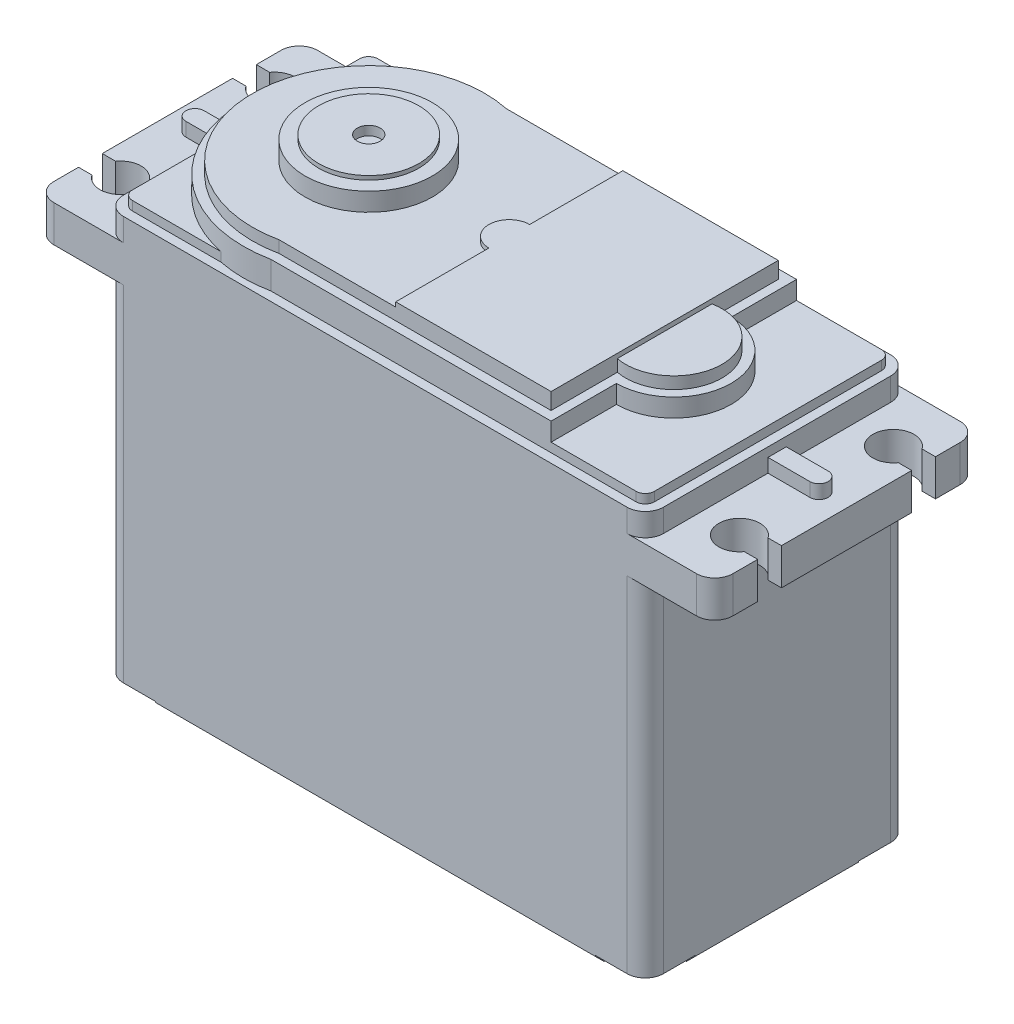
from build123d import *

# Parameters (mm, degrees)
CROQUIS1_W                  = 59.1
CROQUIS1_H                  = 28.85
SALIENTE_EXTRUIR1_DEPTH     = 22.65
CORTAR_EXTRUIR1_DEPTH       = 1.1
CHAFL_N1_SIZE               = 1
REDONDEO1_R                 = 2
SALIENTE_EXTRUIR2_DEPTH     = 4
REDONDEO2_R                 = 2
SALIENTE_EXTRUIR3_DEPTH     = 1.5
SALIENTE_EXTRUIR4_DEPTH     = 1
SALIENTE_EXTRUIR5_DEPTH     = 3
SALIENTE_EXTRUIR6_DEPTH     = 1.3
CROQUIS8_R                  = 6.96
SALIENTE_EXTRUIR7_DEPTH     = 2
CROQUIS9_R                  = 5.485
SALIENTE_EXTRUIR8_DEPTH     = 0.44
CROQUIS10_R                 = 1.25
CORTAR_EXTRUIR2_DEPTH       = 1
TALADRO_DE_MARGEN_PARA_81_D = 4.4958
SALIENTE_EXTRUIR9_DEPTH     = 0.5


with BuildPart() as part:
    # Croquis1 → Saliente-Extruir1 (new, symmetric)
    with BuildSketch(Plane(origin=(0, 0, 0), x_dir=(1, 0, 0), z_dir=(0, 1, 0))):
        Rectangle(CROQUIS1_W, CROQUIS1_H)
    extrude(amount=SALIENTE_EXTRUIR1_DEPTH, both=True)

    # Croquis2 → Cortar-Extruir1 (cut)
    with BuildSketch(Plane.XZ.offset(22.65)):
        with BuildLine():
            Line((29.55, 14.425), (24.05, 14.425))
            Line((24.05, 14.425), (24.05, 10.925))
            ThreePointArc((24.05, 10.925), (24.635786438, 9.510786438), (26.05, 8.925))
            Line((26.05, 8.925), (29.55, 8.925))
            Line((29.55, 8.925), (29.55, 14.425))
        make_face()
        with BuildLine():
            Line((-29.55, 14.425), (-29.55, 8.925))
            Line((-29.55, 8.925), (-26.05, 8.925))
            ThreePointArc((-26.05, 8.925), (-24.635786438, 9.510786438), (-24.05, 10.925))
            Line((-24.05, 10.925), (-24.05, 14.425))
            Line((-24.05, 14.425), (-29.55, 14.425))
        make_face()
        with BuildLine():
            Line((24.05, -14.425), (24.05, -10.925))
            ThreePointArc((24.05, -10.925), (24.635786438, -9.510786438), (26.05, -8.925))
            Line((26.05, -8.925), (29.55, -8.925))
            Line((29.55, -8.925), (29.55, -14.425))
            Line((29.55, -14.425), (24.05, -14.425))
        make_face()
        with BuildLine():
            Line((-24.05, -14.425), (-24.05, -10.925))
            ThreePointArc((-24.05, -10.925), (-24.635786438, -9.510786438), (-26.05, -8.925))
            Line((-26.05, -8.925), (-29.55, -8.925))
            Line((-29.55, -8.925), (-29.55, -14.425))
            Line((-29.55, -14.425), (-24.05, -14.425))
        make_face()
    extrude(amount=-CORTAR_EXTRUIR1_DEPTH, mode=Mode.SUBTRACT)

    # Chaflán1
    chafl_n1_edges = [part.edges().sort_by_distance(p)[0] for p in [
        (29.55, -22.65, 0),
        (0, -22.65, 14.425),
        (0, -22.65, -14.425),
        (-29.55, -22.65, 0),
    ]]
    chamfer(chafl_n1_edges, length=CHAFL_N1_SIZE)

    # Redondeo1
    redondeo1_edges = [part.edges().sort_by_distance(p)[0] for p in [
        (29.55, 0.55, 14.425),
        (-29.55, 0.55, 14.425),
        (-29.55, 0.55, -14.425),
        (29.55, 0.55, -14.425),
    ]]
    fillet(redondeo1_edges, radius=REDONDEO1_R)

    # Croquis3 → Saliente-Extruir2 (add)
    with BuildSketch(Plane(origin=(0, 16.15, 0), x_dir=(1, 0, 0), z_dir=(0, 1, 0))):
        with BuildLine():
            Line((27.55, 14.425), (37.15, 14.425))
            Line((37.15, 14.425), (37.15, 9.725))
            Line((37.15, 9.725), (35.599971428, 9.725))
            Line((35.599971428, 9.725), (35.599971428, 7.125))
            Line((35.599971428, 7.125), (37.15, 7.125))
            Line((37.15, 7.125), (37.15, -7.125))
            Line((37.15, -7.125), (35.599971428, -7.125))
            Line((35.599971428, -7.125), (35.599971428, -9.725))
            Line((35.599971428, -9.725), (37.15, -9.725))
            Line((37.15, -9.725), (37.15, -14.425))
            Line((37.15, -14.425), (27.55, -14.425))
            ThreePointArc((27.55, -14.425), (28.964213562, -13.839213562), (29.55, -12.425))
            Line((29.55, -12.425), (29.55, 12.425))
            ThreePointArc((29.55, 12.425), (28.964213562, 13.839213562), (27.55, 14.425))
        make_face()
        with BuildLine():
            Line((-37.15, -9.725), (-37.15, -14.425))
            Line((-37.15, -14.425), (-27.55, -14.425))
            ThreePointArc((-27.55, -14.425), (-28.964213562, -13.839213562), (-29.55, -12.425))
            Line((-29.55, -12.425), (-29.55, 12.425))
            ThreePointArc((-29.55, 12.425), (-28.964213562, 13.839213562), (-27.55, 14.425))
            Line((-27.55, 14.425), (-37.15, 14.425))
            Line((-37.15, 14.425), (-37.15, 9.725))
            Line((-37.15, 9.725), (-35.599971428, 9.725))
            Line((-35.599971428, 9.725), (-35.599971428, 7.125))
            Line((-35.599971428, 7.125), (-37.15, 7.125))
            Line((-37.15, 7.125), (-37.15, -7.125))
            Line((-37.15, -7.125), (-35.599971428, -7.125))
            Line((-35.599971428, -7.125), (-35.599971428, -9.725))
            Line((-35.599971428, -9.725), (-37.15, -9.725))
        make_face()
    extrude(amount=SALIENTE_EXTRUIR2_DEPTH)

    # Redondeo2
    redondeo2_edges = [part.edges().sort_by_distance(p)[0] for p in [
        (37.15, 18.15, 14.425),
        (37.15, 18.15, -14.425),
        (-37.15, 18.15, 14.425),
        (-37.15, 18.15, -14.425),
    ]]
    fillet(redondeo2_edges, radius=REDONDEO2_R)

    # Croquis4 → Saliente-Extruir3 (add)
    with BuildSketch(Plane(origin=(0, 20.15, 0), x_dir=(1, 0, 0), z_dir=(0, 1, 0))):
        with BuildLine():
            Line((34.13221447, -1), (29.55, -1))
            Line((29.55, -1), (29.55, 1))
            Line((29.55, 1), (34.13221447, 1))
            ThreePointArc((34.13221447, 1), (35.13221447, 0), (34.13221447, -1))
        make_face()
        with BuildLine():
            Line((-29.55, -1), (-29.55, 1))
            Line((-29.55, 1), (-34.13221447, 1))
            ThreePointArc((-34.13221447, 1), (-35.13221447, 0), (-34.13221447, -1))
            Line((-34.13221447, -1), (-29.55, -1))
        make_face()
    extrude(amount=SALIENTE_EXTRUIR3_DEPTH)

    # Croquis5 → Saliente-Extruir4 (add)
    with BuildSketch(Plane(origin=(0, 22.65, 0), x_dir=(1, 0, 0), z_dir=(0, 1, 0))):
        with BuildLine():
            Line((-27.55, -13.425), (27.55, -13.425))
            ThreePointArc((27.55, -13.425), (28.257106781, -13.132106781), (28.55, -12.425))
            Line((28.55, -12.425), (28.55, 12.425))
            ThreePointArc((28.55, 12.425), (28.257106781, 13.132106781), (27.55, 13.425))
            Line((27.55, 13.425), (-27.55, 13.425))
            ThreePointArc((-27.55, 13.425), (-28.257106781, 13.132106781), (-28.55, 12.425))
            Line((-28.55, 12.425), (-28.55, -12.425))
            ThreePointArc((-28.55, -12.425), (-28.257106781, -13.132106781), (-27.55, -13.425))
        make_face()
    extrude(amount=SALIENTE_EXTRUIR4_DEPTH)

    # Croquis6 → Saliente-Extruir5 (add)
    with BuildSketch(Plane(origin=(0, 22.65, 0), x_dir=(1, 0, 0), z_dir=(0, 1, 0))):
        with BuildLine():
            Line((-12.39381436, 13.425), (18.25, 13.425))
            Line((18.25, 13.425), (18.25, 6.275))
            ThreePointArc((18.25, 6.275), (24.525, 0), (18.25, -6.275))
            Line((18.25, -6.275), (18.25, -13.425))
            Line((18.25, -13.425), (-12.39381436, -13.425))
            ThreePointArc((-12.39381436, -13.425), (-28.825, 0), (-12.39381436, 13.425))
        make_face()
    extrude(amount=SALIENTE_EXTRUIR5_DEPTH)

    # Croquis7 → Saliente-Extruir6 (add)
    with BuildSketch(Plane(origin=(0, 25.65, 0), x_dir=(1, 0, 0), z_dir=(0, 1, 0))):
        with BuildLine():
            Line((17.25, 5.179346001), (17.25, 12.425))
            Line((17.25, 12.425), (-12.496430998, 12.425))
            ThreePointArc((-12.496430998, 12.425), (-27.825, 0), (-12.496430998, -12.425))
            Line((-12.496430998, -12.425), (17.25, -12.425))
            Line((17.25, -12.425), (17.25, -5.179346001))
            ThreePointArc((17.25, -5.179346001), (23.525, 0), (17.25, 5.179346001))
        make_face()
    extrude(amount=SALIENTE_EXTRUIR6_DEPTH)

    # Croquis8 → Saliente-Extruir7 (add)
    with BuildSketch(Plane(origin=(0, 26.95, 0), x_dir=(1, 0, 0), z_dir=(0, 1, 0))):
        with Locations(Location((-15.125, 0, 0), (0, 0, 270))):
            Circle(CROQUIS8_R)
    extrude(amount=SALIENTE_EXTRUIR7_DEPTH)

    # Croquis9 → Saliente-Extruir8 (add)
    with BuildSketch(Plane(origin=(0, 28.95, 0), x_dir=(1, 0, 0), z_dir=(0, 1, 0))):
        with Locations(Location((-15.125, 0, 0), (0, 0, 270))):
            Circle(CROQUIS9_R)
    extrude(amount=SALIENTE_EXTRUIR8_DEPTH)

    # Croquis10 → Cortar-Extruir2 (cut)
    with BuildSketch(Plane(origin=(0, 29.39, 0), x_dir=(1, 0, 0), z_dir=(0, 1, 0))):
        with Locations(Location((-15.125, 0, 0), (0, 0, 270))):
            Circle(CROQUIS10_R)
    extrude(amount=-CORTAR_EXTRUIR2_DEPTH, mode=Mode.SUBTRACT)

    # Croquis11 → Taladro de margen para M1.61 (revolve, cut)
    with BuildSketch(Plane(origin=(27.05, -21.55, -11.925), x_dir=(0, 0, -1), z_dir=(1, 0, 0))):
        Polygon((0, 0), (0, 5.540774557), (0.9, 5), (0.9, 0), align=None)
    taladro_de_margen_para_m1_61 = revolve(axis=Axis((27.05, -27.9, -11.925), (0, 1, 0)), mode=Mode.SUBTRACT)

    # Simetría1: Taladro de margen para M1.61 across plane
    add(taladro_de_margen_para_m1_61.mirror(Plane.XY), mode=Mode.SUBTRACT)

    # Simetría2: Taladro de margen para M1.61 across plane
    add(taladro_de_margen_para_m1_61.mirror(Plane(origin=(0, 0, 0), x_dir=(0, 0, 1), z_dir=(1, 0, 0))), mode=Mode.SUBTRACT)

    # Simetría2 copy 1 sketch → Simetría2 copy 1 (revolve, cut)
    with BuildSketch(Plane(origin=(-27.05, -21.55, 11.925), x_dir=(0, 0, 1), z_dir=(-1, 0, 0))):
        Polygon((0, 0), (0, 5.540774557), (0.9, 5), (0.9, 0), align=None)
    revolve(axis=Axis((-27.05, -27.9, 11.925), (0, 1, 0)), mode=Mode.SUBTRACT)

    # Taladro de margen para #81 (through all)
    with Locations(Plane(origin=(0, 20.15, 0), x_dir=(1, 0, 0), z_dir=(0, 1, 0))):
        with Locations((33.85, 8.425), (33.85, -8.425), (-33.85, 8.425), (-33.85, -8.425)):
            Hole(TALADRO_DE_MARGEN_PARA_81_D / 2)

    # Croquis15 → Saliente-Extruir9 (add)
    with BuildSketch(Plane(origin=(0, 26.95, 0), x_dir=(1, 0, 0), z_dir=(0, 1, 0))):
        with BuildLine():
            Line((17.25, 12.425), (0.25, 12.425))
            Line((0.25, 12.425), (0.25, 2.23))
            ThreePointArc((0.25, 2.23), (-1.98, 0), (0.25, -2.23))
            Line((0.25, -2.23), (0.25, -12.425))
            Line((0.25, -12.425), (17.25, -12.425))
            Line((17.25, -12.425), (17.25, 12.425))
        make_face()
    extrude(amount=SALIENTE_EXTRUIR9_DEPTH)

    # Croquis17 → Recubrir1 section 0
    with BuildSketch(Plane.ZY.offset(29.55)):
        with BuildLine():
            Line((-3.62, -14.39), (3.62, -14.39))
            Line((3.62, -14.39), (3.62, -18.8))
            Line((3.62, -18.8), (-3.62, -18.8))
            Line((-3.62, -18.8), (-3.62, -14.39))
        make_face()
    # Croquis18 → Recubrir1 section 1
    with BuildSketch(Plane.ZY.offset(35.55)):
        with BuildLine():
            Line((3.12, -14.89), (-3.12, -14.89))
            Line((-3.12, -14.89), (-3.12, -18.3))
            Line((-3.12, -18.3), (3.12, -18.3))
            Line((3.12, -18.3), (3.12, -14.89))
        make_face()
    loft()


solid = part.part
